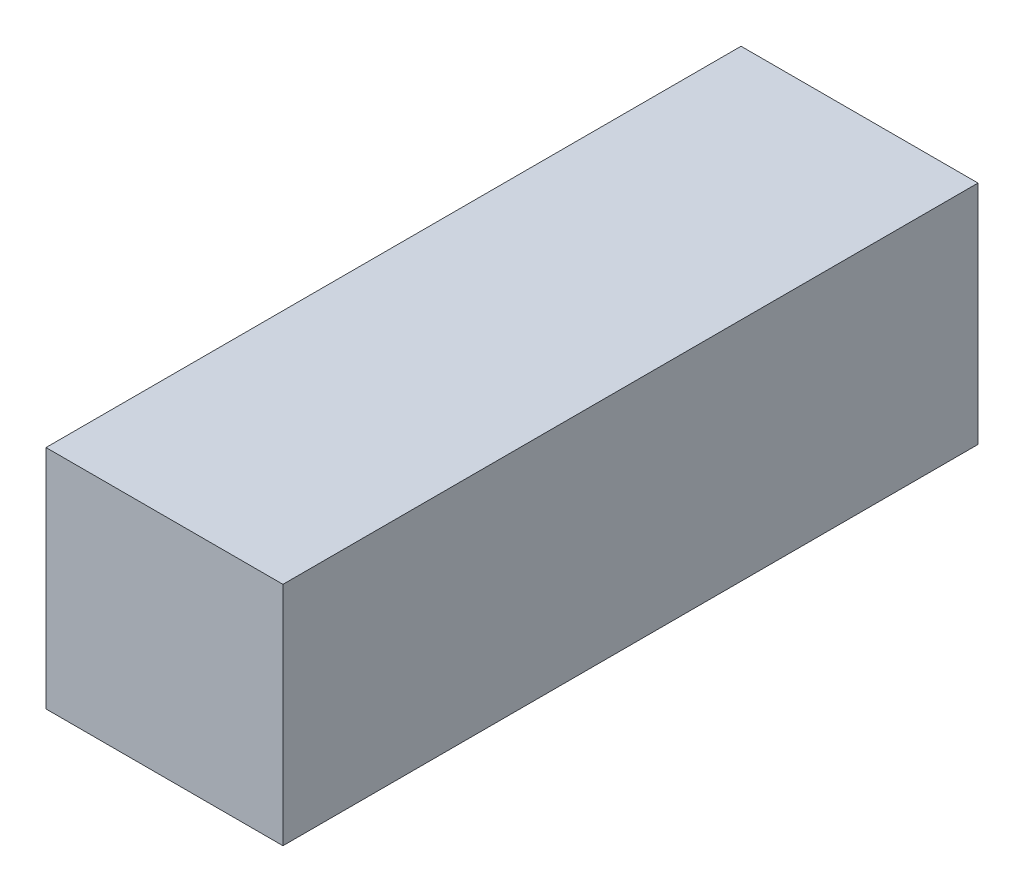
from build123d import *

# Parameters (mm, degrees)
IZIM1_W                     = 45
IZIM1_H                     = 43
Y_KSEKLIK_EKSTR_ZYON1_DEPTH = 132


with BuildPart() as part:
    # Çizim1 → Yükseklik-Ekstrüzyon1 (new body)
    with BuildSketch(Plane.XY):
        Rectangle(IZIM1_W, IZIM1_H)
    extrude(amount=Y_KSEKLIK_EKSTR_ZYON1_DEPTH)


solid = part.part
